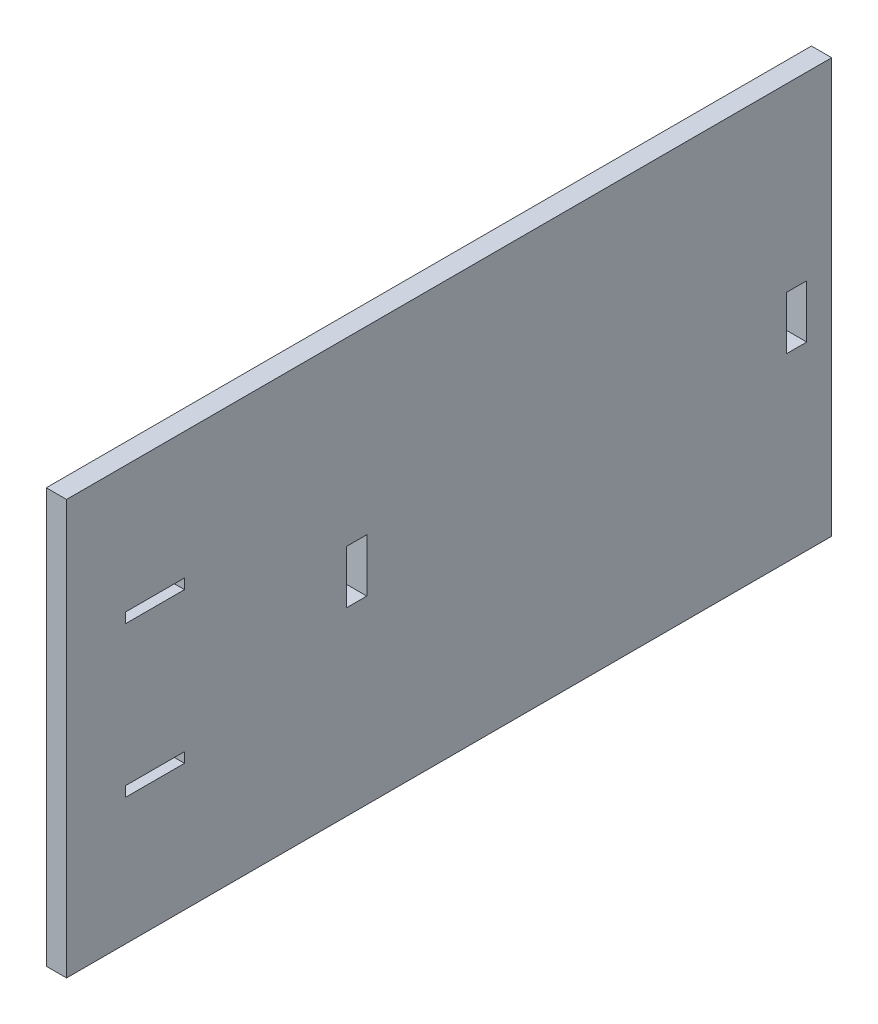
from build123d import *

# Parameters (mm, degrees)
SKETCH1_W           = 240
SKETCH1_H           = 130
SKETCH1_W_2         = 6.35
SKETCH1_H_2         = 16.666666667
SKETCH1_W_3         = 18.5
SKETCH1_H_3         = 3.175
BOSS_EXTRUDE1_DEPTH = 6.35


with BuildPart() as part:
    # Sketch1 → Boss-Extrude1 (new body)
    with BuildSketch(Plane(origin=(0, 0, 0), x_dir=(0, 0, -1), z_dir=(1, 0, 0))):
        with Locations((120, 65)):
            Rectangle(SKETCH1_W, SKETCH1_H)
        with Locations((91, 64.996666667)):
            Rectangle(SKETCH1_W_2, SKETCH1_H_2, mode=Mode.SUBTRACT)
        with Locations((229, 65.003333333)):
            Rectangle(SKETCH1_W_2, SKETCH1_H_2, mode=Mode.SUBTRACT)
        with Locations((27.75, 88.5875)):
            Rectangle(SKETCH1_W_3, SKETCH1_H_3, mode=Mode.SUBTRACT)
        with Locations((27.75, 41.4125)):
            Rectangle(SKETCH1_W_3, SKETCH1_H_3, mode=Mode.SUBTRACT)
    extrude(amount=BOSS_EXTRUDE1_DEPTH)


solid = part.part
